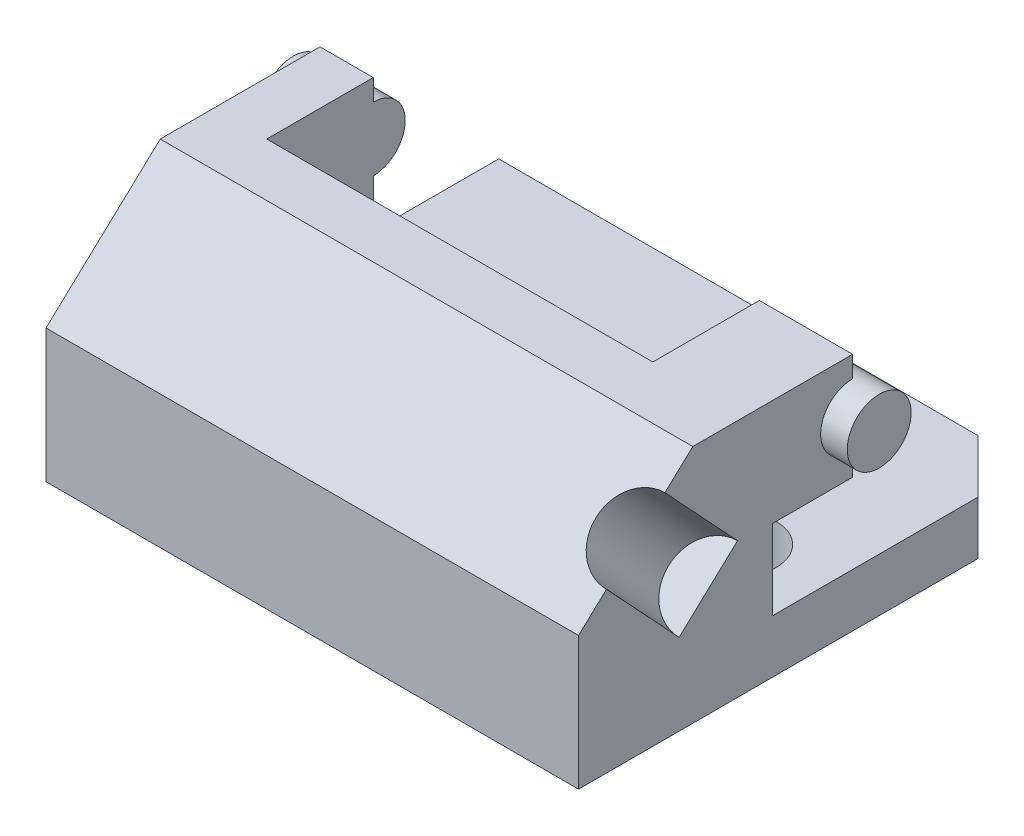
from build123d import *

# Parameters (mm, degrees)
ESQUISSE1_R             = 6
BOSS_EXTRU_1_DEPTH      = 100
ESQUISSE2_R             = 6
BOSS_EXTRU_2_DEPTH      = 5
BOSS_EXTRU_3_START      = 5
ESQUISSE3_R             = 6
BOSS_EXTRU_3_DEPTH      = 5
ENL_V_MAT_EXTRU_1_DEPTH = 20
ENL_V_MAT_EXTRU_3_REACH = 126.126
ESQUISSE5_W             = 72.5
ESQUISSE5_H             = 20
ESQUISSE6_W             = 72.5
ESQUISSE6_H             = 6
ENL_V_MAT_EXTRU_4_DEPTH = 40
ENL_V_MAT_EXTRU_5_DEPTH = 10
ENL_V_MAT_EXTRU_6_DEPTH = 10


with BuildPart() as part:
    # Esquisse1 → Boss.-Extru.1 (new body)
    with BuildSketch(Plane(origin=(0, 0, 0), x_dir=(0, 0, -1), z_dir=(1, 0, 0))):
        with BuildLine():
            Line((48.5526258, 0), (0, 0))
            Line((0, 0), (0, 15))
            Line((0, 15), (15, 15))
            Line((15, 15), (15, 19))
            ThreePointArc((15, 19), (9, 25), (15, 31))
            Line((15, 31), (15, 35))
            Line((15, 35), (-15, 35))
            Line((-15, 35), (-36.4473742, 15))
            Line((-36.4473742, 15), (-36.4473742, -10))
            Line((-36.4473742, -10), (48.5526258, -10))
            Line((48.5526258, -10), (48.5526258, 0))
        make_face()
        with Locations((15, 25)):
            Circle(ESQUISSE1_R)
    extrude(amount=BOSS_EXTRU_1_DEPTH)

    # Esquisse2 → Boss.-Extru.2 (add)
    with BuildSketch(Plane(origin=(100, 0, 0), x_dir=(0, 0, -1), z_dir=(1, 0, 0))):
        with Locations(Location((15, 25, 0), (0, 0, 90))):
            Circle(ESQUISSE2_R)
    extrude(amount=BOSS_EXTRU_2_DEPTH)

    # Esquisse3 → Boss.-Extru.3 (add)
    with BuildSketch(Plane.ZY.offset(BOSS_EXTRU_3_START)):
        with Locations((-15, 25)):
            Circle(ESQUISSE3_R)
    extrude(amount=-BOSS_EXTRU_3_DEPTH)

    # Esquisse4 → Enlèv. mat.-Extru.1 (cut)
    with BuildSketch(Plane(origin=(0, 26.202468667, 24.434197326), x_dir=(1, 0, 0), z_dir=(0, 0.7313537016191716, 0.6819983600624975))):
        with BuildLine():
            ThreePointArc((107.5, -1.763154778), (105.303300859, 3.54014608), (100, 5.736845222))
            Line((100, 5.736845222), (100, -1.763154778))
            Line((100, -1.763154778), (100, -9.263154778))
            ThreePointArc((100, -9.263154778), (105.303300859, -7.066455637), (107.5, -1.763154778))
        make_face()
        with BuildLine():
            Line((100, -1.763154778), (100, 5.736845222))
            ThreePointArc((100, 5.736845222), (92.5, -1.763154778), (100, -9.263154778))
            Line((100, -9.263154778), (100, -1.763154778))
        make_face()
    extrude(amount=-ENL_V_MAT_EXTRU_1_DEPTH, mode=Mode.SUBTRACT)

    # Enlèv. mat.-Extru.3: up to this face of the body (flat: up to its plane)
    enl_v_mat_extru_3_end = Plane(part.part.faces().sort_by_distance((50, 0, -24.2763129))[0])
    # Esquisse5 → Enlèv. mat.-Extru.3 (cut, up to the picked face)
    with BuildSketch(Plane(origin=(0, 35, 0), x_dir=(1, 0, 0), z_dir=(0, 1, 0)), mode=Mode.PRIVATE) as enl_v_mat_extru_3_sk1:
        with Locations((46.25, 5)):
            Rectangle(ESQUISSE5_W, ESQUISSE5_H)
    enl_v_mat_extru_3_tool1 = split(extrude(enl_v_mat_extru_3_sk1.sketch, amount=-ENL_V_MAT_EXTRU_3_REACH, mode=Mode.PRIVATE), bisect_by=enl_v_mat_extru_3_end, keep=Keep.BOTH, mode=Mode.PRIVATE)
    add(enl_v_mat_extru_3_tool1.solids().sort_by(Axis((46.25, 35, -5), (0, -1, 0)))[0], mode=Mode.SUBTRACT)

    # Esquisse6 → Enlèv. mat.-Extru.4 (cut)
    with BuildSketch(Plane(origin=(0, 0, 0), x_dir=(1, 0, 0), z_dir=(0, 1, 0))):
        with Locations((46.25, 18)):
            Rectangle(ESQUISSE6_W, ESQUISSE6_H)
    extrude(amount=ENL_V_MAT_EXTRU_4_DEPTH, mode=Mode.SUBTRACT)

    # Esquisse7 → Enlèv. mat.-Extru.5 (cut)
    with BuildSketch(Plane.XZ.offset(10)):
        with BuildLine():
            ThreePointArc((22.5, -8.148997132), (15, -0.648997132), (7.5, -8.148997132))
            Line((7.5, -8.148997132), (15, -8.148997132))
            Line((15, -8.148997132), (22.5, -8.148997132))
        make_face()
        with BuildLine():
            Line((15, -8.148997132), (7.5, -8.148997132))
            ThreePointArc((7.5, -8.148997132), (15, -15.648997132), (22.5, -8.148997132))
            Line((22.5, -8.148997132), (15, -8.148997132))
        make_face()
        with BuildLine():
            ThreePointArc((35, -0.648997132), (29.696699141, -2.845696273), (27.5, -8.148997132))
            Line((27.5, -8.148997132), (35, -8.148997132))
            Line((35, -8.148997132), (65, -8.148997132))
            Line((65, -8.148997132), (72.5, -8.148997132))
            ThreePointArc((72.5, -8.148997132), (70.303300859, -2.845696273), (65, -0.648997132))
            Line((65, -0.648997132), (35, -0.648997132))
        make_face()
        with BuildLine():
            Line((35, -8.148997132), (27.5, -8.148997132))
            ThreePointArc((27.5, -8.148997132), (29.696699141, -13.452297991), (35, -15.648997132))
            Line((35, -15.648997132), (65, -15.648997132))
            ThreePointArc((65, -15.648997132), (70.303300859, -13.452297991), (72.5, -8.148997132))
            Line((72.5, -8.148997132), (65, -8.148997132))
            Line((65, -8.148997132), (35, -8.148997132))
        make_face()
        with BuildLine():
            ThreePointArc((92.5, -8.148997132), (85, -0.648997132), (77.5, -8.148997132))
            Line((77.5, -8.148997132), (85, -8.148997132))
            Line((85, -8.148997132), (92.5, -8.148997132))
        make_face()
        with BuildLine():
            Line((85, -8.148997132), (77.5, -8.148997132))
            ThreePointArc((77.5, -8.148997132), (85, -15.648997132), (92.5, -8.148997132))
            Line((92.5, -8.148997132), (85, -8.148997132))
        make_face()
    extrude(amount=-ENL_V_MAT_EXTRU_5_DEPTH, mode=Mode.SUBTRACT)

    # Esquisse8 → Enlèv. mat.-Extru.6 (cut)
    with BuildSketch(Plane.XZ.offset(10)):
        Polygon((100, -48.5526258), (100, -38.5526258), (90, -48.5526258), align=None)
    extrude(amount=-ENL_V_MAT_EXTRU_6_DEPTH, mode=Mode.SUBTRACT)


solid = part.part
